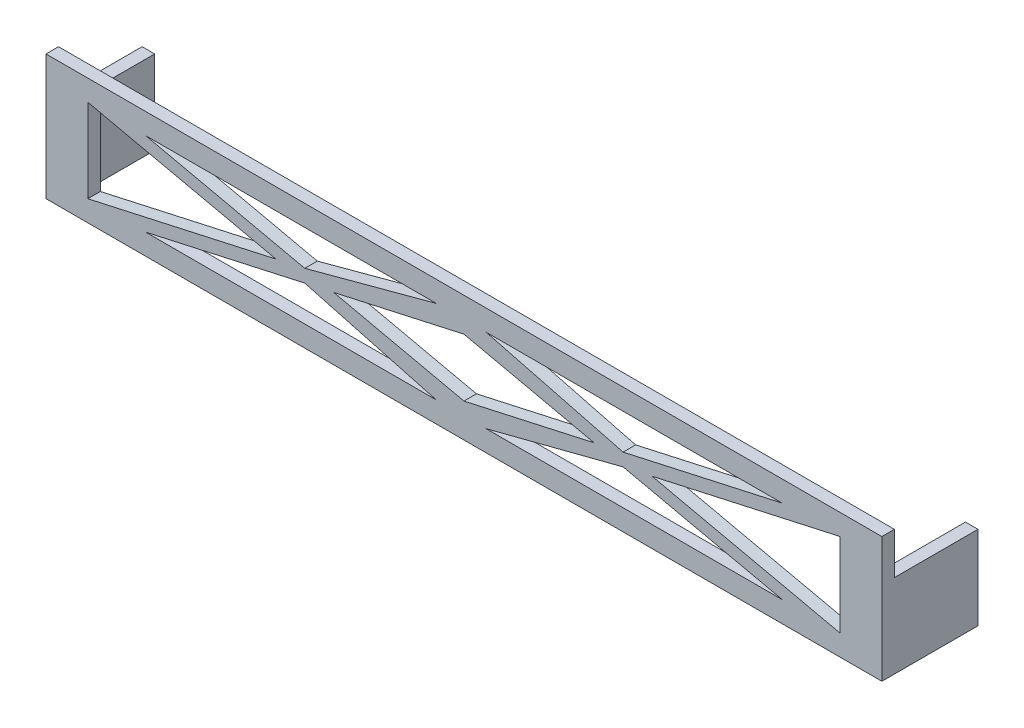
from build123d import *

# Parameters (mm, degrees)
CROQUIS1_W              = 200
CROQUIS1_H              = 30
SALIENTE_EXTRUIR1_DEPTH = 3
CROQUIS2_W              = 3
CROQUIS2_H              = 20
SALIENTE_EXTRUIR2_DEPTH = 23


with BuildPart() as part:
    # Croquis1 → Saliente-Extruir1 (new body)
    with BuildSketch(Plane.XY):
        with Locations((-118.159579588, 33.85177453)):
            Rectangle(CROQUIS1_W, CROQUIS1_H)
        Polygon((-28.159579588, 43.85177453), (-28.159579588, 23.85177453), (-73.159579588, 33.85177453), align=None, mode=Mode.SUBTRACT)
        Polygon((-208.159579588, 43.85177453), (-163.159579588, 33.85177453), (-208.159579588, 23.85177453), align=None, mode=Mode.SUBTRACT)
        Polygon((-194.330262902, 43.85177453), (-156.244921245, 35.388365273), (-124.77138853, 43.85177453), align=None, mode=Mode.SUBTRACT)
        Polygon((-194.330262902, 23.85177453), (-156.244921245, 32.315183787), (-124.77138853, 23.85177453), align=None, mode=Mode.SUBTRACT)
        Polygon((-118.159579588, 40.778593045), (-149.330262902, 33.85177453), (-118.159579588, 26.924956016), (-86.988896274, 33.85177453), align=None, mode=Mode.SUBTRACT)
        Polygon((-41.988896274, 23.85177453), (-80.074237931, 32.315183787), (-112.871999428, 23.85177453), align=None, mode=Mode.SUBTRACT)
        Polygon((-41.988896274, 43.85177453), (-80.074237931, 35.388365273), (-112.871999428, 43.85177453), align=None, mode=Mode.SUBTRACT)
    extrude(amount=SALIENTE_EXTRUIR1_DEPTH)

    # Croquis2 → Saliente-Extruir2 (add)
    with BuildSketch(Plane.XY.offset(3)):
        with Locations((-216.659579588, 28.85177453)):
            Rectangle(CROQUIS2_W, CROQUIS2_H)
        with Locations((-19.659579588, 28.85177453)):
            Rectangle(CROQUIS2_W, CROQUIS2_H)
    extrude(amount=-SALIENTE_EXTRUIR2_DEPTH)


solid = part.part
